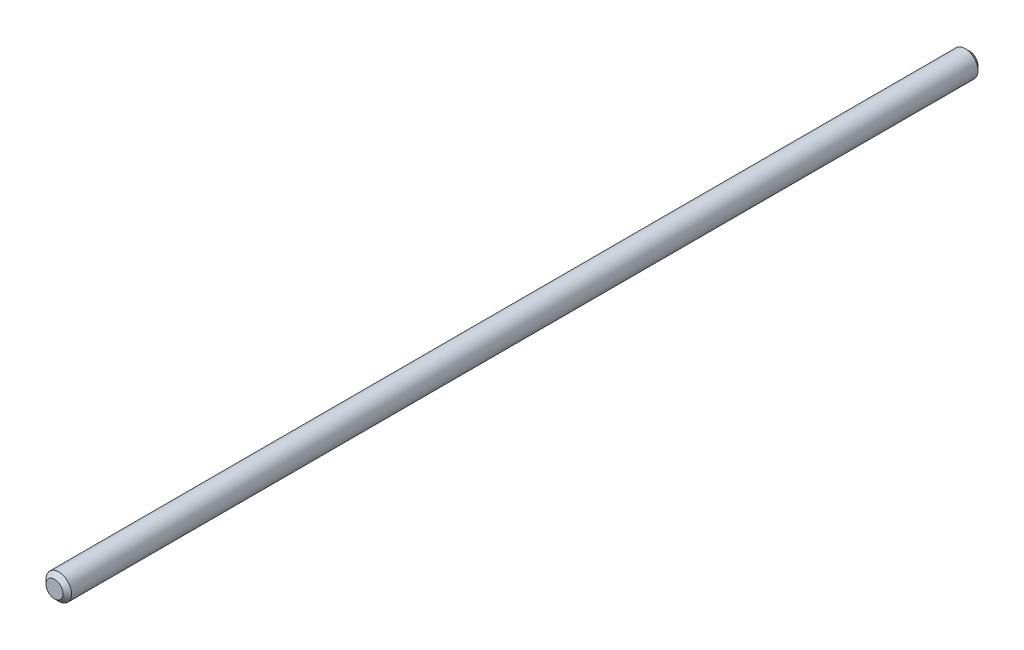
from build123d import *

# Parameters (mm, degrees)
SKETCH1_R           = 3
BOSS_EXTRUDE1_DEPTH = 107.5
CHAMFER1_SIZE       = 1


with BuildPart() as part:
    # Sketch1 → Boss-Extrude1 (new, symmetric)
    with BuildSketch(Plane.XY):
        Circle(SKETCH1_R)
    extrude(amount=BOSS_EXTRUDE1_DEPTH, both=True)

    # Chamfer1
    chamfer1_edges = [part.edges().sort_by_distance(p)[0] for p in [
        (-3, 0, -107.5),
        (-3, 0, 107.5),
    ]]
    chamfer(chamfer1_edges, length=CHAMFER1_SIZE)


solid = part.part
